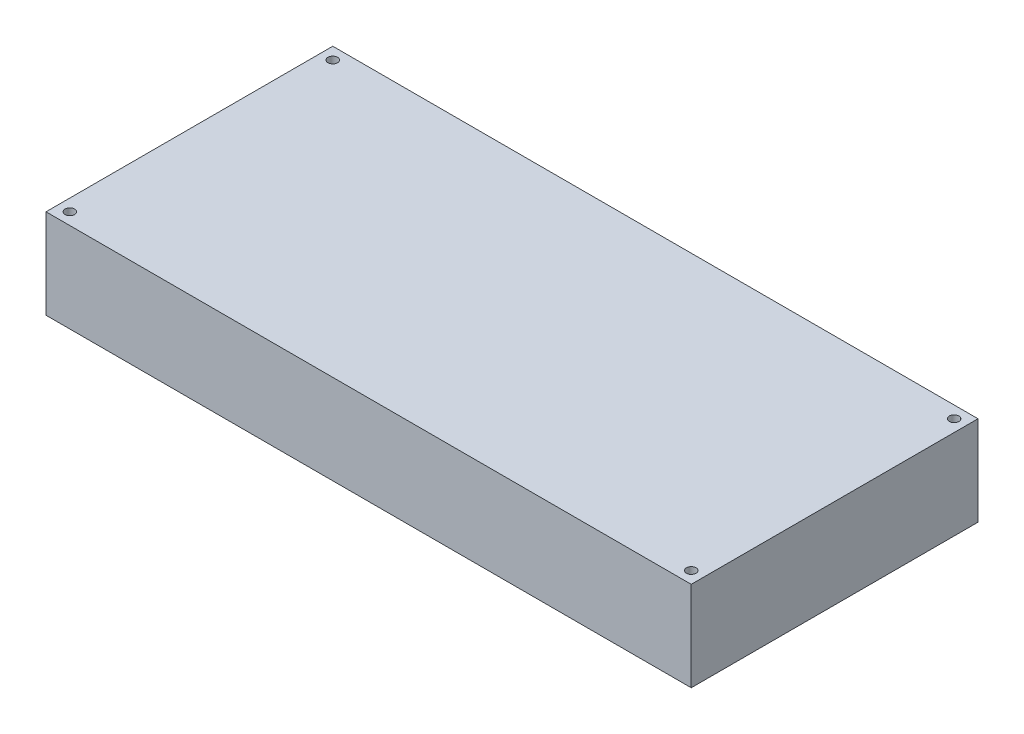
from build123d import *

# Parameters (mm, degrees)
SKETCH_1_W      = 108
SKETCH_1_H      = 48
SKETCH_1_R      = 0.802985819
EXTRUDE_1_DEPTH = 15


with BuildPart() as part:
    # 草图1 → 凸台-拉伸1 (new body)
    with BuildSketch(Plane(origin=(0, 0, 0), x_dir=(1, 0, 0), z_dir=(0, 1, 0))):
        Rectangle(SKETCH_1_W, SKETCH_1_H)
        with Locations(Location((-52, 22, 0), (0, 0, 270))):
            Circle(SKETCH_1_R, mode=Mode.SUBTRACT)
        with Locations(Location((-52, -22, 0), (0, 0, 90))):
            Circle(SKETCH_1_R, mode=Mode.SUBTRACT)
        with Locations(Location((52, -22, 0), (0, 0, 270))):
            Circle(SKETCH_1_R, mode=Mode.SUBTRACT)
        with Locations(Location((52, 22, 0), (0, 0, 90))):
            Circle(SKETCH_1_R, mode=Mode.SUBTRACT)
    extrude(amount=EXTRUDE_1_DEPTH)


solid = part.part
